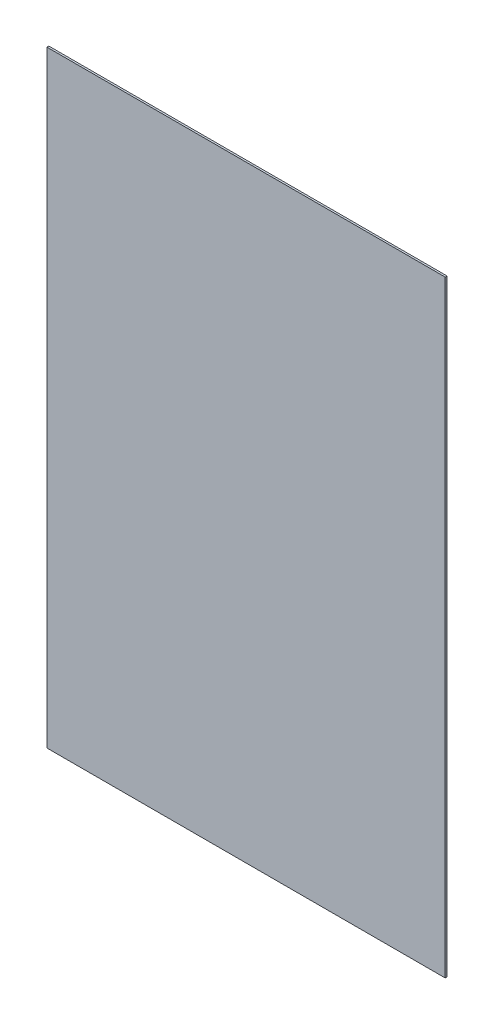
from build123d import *

# Parameters (mm, degrees)
SKETCH_1_W      = 210
SKETCH_1_H      = 320
EXTRUDE_1_DEPTH = 1


with BuildPart() as part:
    # 草图1 → 凸台-拉伸1 (new body)
    with BuildSketch(Plane.XY):
        with Locations((-105, 160)):
            Rectangle(SKETCH_1_W, SKETCH_1_H)
    extrude(amount=EXTRUDE_1_DEPTH)


solid = part.part
